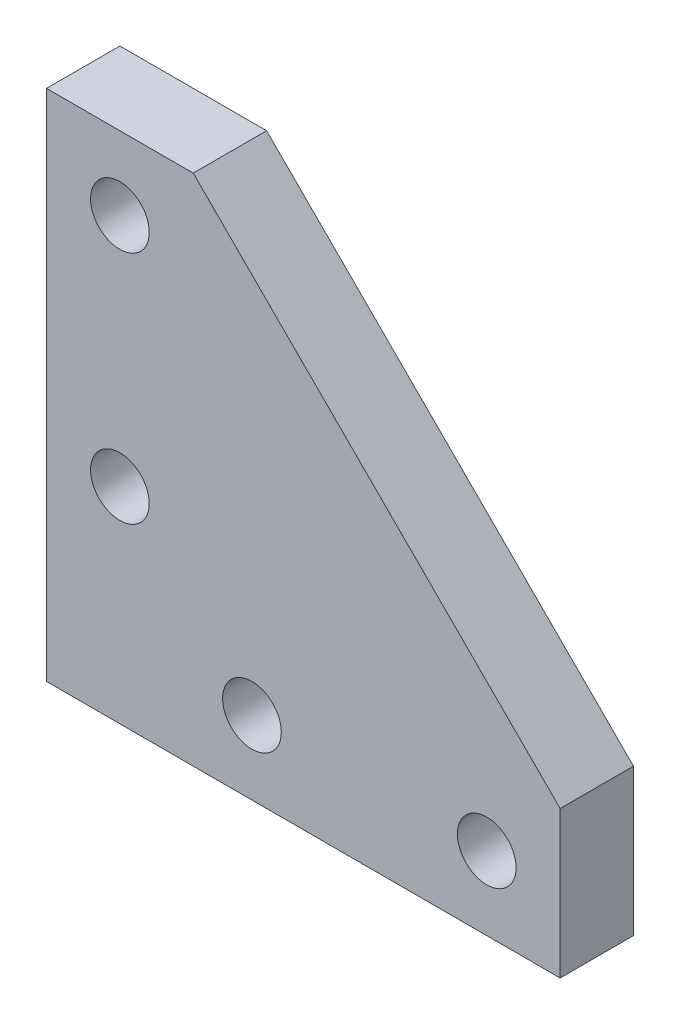
from build123d import *

# Parameters (mm, degrees)
BOSS_EXTRU_1_DEPTH      = 5
ESQUISSE2_R             = 2
ENL_V_MAT_EXTRU_1_DEPTH = 5


with BuildPart() as part:
    # Esquisse1 → Boss.-Extru.1 (new body)
    with BuildSketch(Plane.XY):
        Polygon((0, 0), (35, 0), (35, 10), (10, 35), (0, 35), align=None)
    extrude(amount=BOSS_EXTRU_1_DEPTH)

    # Esquisse2 → Enlèv. mat.-Extru.1 (cut)
    with BuildSketch(Plane.XY.offset(5)):
        with Locations((14, 5)):
            Circle(ESQUISSE2_R)
        with Locations((30, 5)):
            Circle(ESQUISSE2_R)
        with Locations((5, 30)):
            Circle(ESQUISSE2_R)
        with Locations((5, 14)):
            Circle(ESQUISSE2_R)
    extrude(amount=-ENL_V_MAT_EXTRU_1_DEPTH, mode=Mode.SUBTRACT)


solid = part.part
